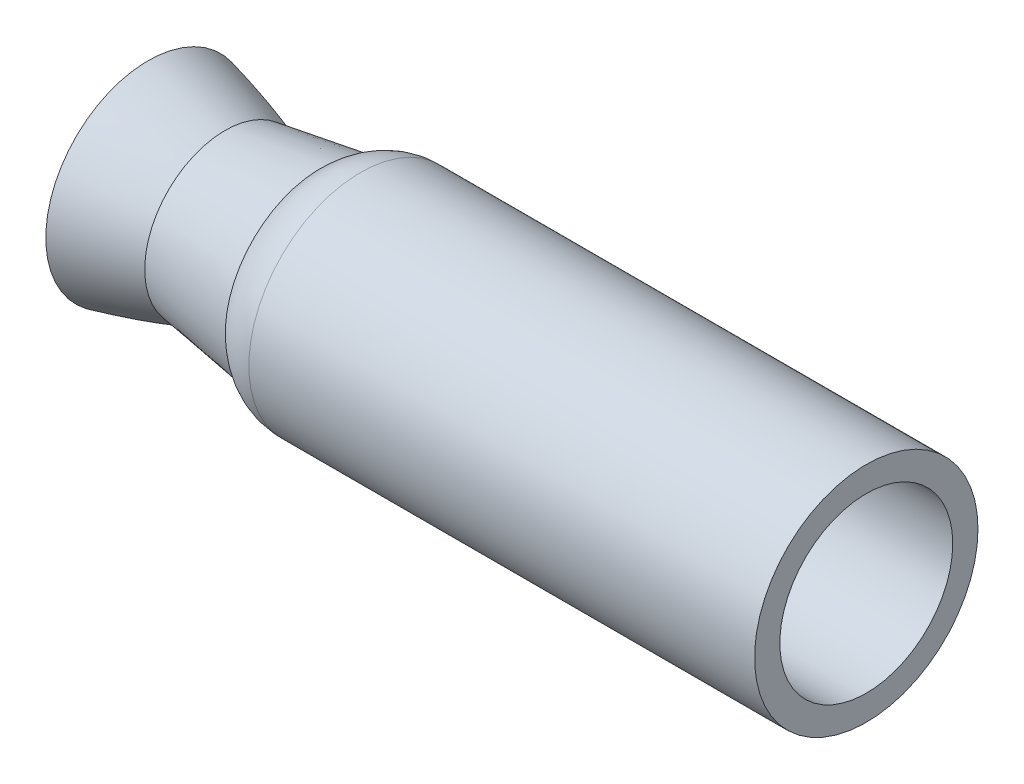
from build123d import *


with BuildPart() as part:
    # Sketch1 → Revolve1 (revolve)
    with BuildSketch(Plane.XY, mode=Mode.PRIVATE) as revolve1_sk:
        with BuildLine():
            Line((28.949236933, 27.386004017), (189.133015331, 27.386004017))
            Line((189.133015331, 27.386004017), (189.133015331, 35.386004017))
            Line((189.133015331, 35.386004017), (28.949236933, 35.386004017))
            ThreePointArc((28.949236933, 35.386004017), (22.060935151, 34.015835602), (16.221314872, 30.113926078))
            Line((16.221314872, 30.113926078), (7.884849119, 21.777460326))
            ThreePointArc((7.884849119, 21.777460326), (5.344435892, 20.007381854), (2.348184674, 19.226769399))
            add(Edge.make_bspline(
                [(2.348184674, 19.226769399), (0.313545637, 20.077506038), (-5.800272608, 22.518234312), (-11.933859147, 24.735791909), (-13.981586932, 25.43765231)],
                knots=[0.018493807, 0.018493807, 0.018493807, 0.117487589, 0.315475154, 0.414468937, 0.414468937, 0.414468937], degree=2))
            add(Edge.make_bspline(
                [(-13.981586932, 25.43765231), (-16.029314717, 26.139512711), (-28.160190771, 30.070121673), (-38.315022829, 32.432092239)],
                knots=[0.414468937, 0.414468937, 0.414468937, 0.513462719, 1, 1, 1], degree=2))
            Line((-38.315022829, 32.432092239), (-40.127010283, 24.64))
            add(Edge.make_bspline(
                [(-8.337690555, 14.885570905), (-24.160193055, 20.927046968), (-40.127010283, 24.64)],
                knots=[0.208731219, 0.208731219, 0.208731219, 1, 1, 1], degree=2))
            ThreePointArc((-8.337690555, 14.885570905), (2.839826237, 16.044626201), (13.541703369, 19.472470519))
            ThreePointArc((13.541703369, 19.472470519), (16.609976492, 20.839222591), (19.662309445, 22.241212152))
            Line((19.662309445, 22.241212152), (21.878169121, 24.457071829))
            ThreePointArc((21.878169121, 24.457071829), (25.12240261, 26.624799342), (28.949236933, 27.386004017))
        make_face()
        with BuildLine():
            Line((7.884849119, 21.777460326), (16.221314872, 30.113926078))
            Line((16.221314872, 30.113926078), (-13.981586932, 25.43765231))
            add(Edge.make_bspline(
                [(2.348184674, 19.226769399), (0.313545637, 20.077506038), (-5.800272608, 22.518234312), (-11.933859147, 24.735791909), (-13.981586932, 25.43765231)],
                knots=[0.018493807, 0.018493807, 0.018493807, 0.117487589, 0.315475154, 0.414468937, 0.414468937, 0.414468937], degree=2))
            ThreePointArc((2.348184674, 19.226769399), (5.344435892, 20.007381854), (7.884849119, 21.777460326))
        make_face()
    revolve(revolve1_sk.sketch.rotate(Axis((0, 0, 0), (-1, 0, 0)), 90), axis=Axis((0, 0, 0), (-1, 0, 0)))


solid = part.part
